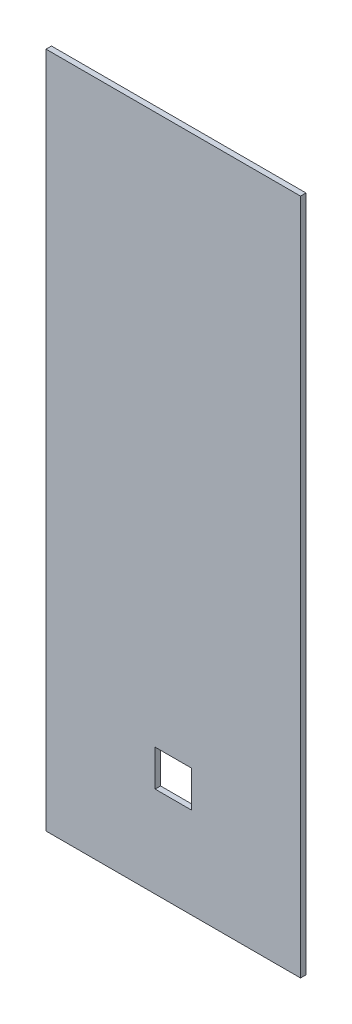
from build123d import *

# Parameters (mm, degrees)
SKETCH1_W           = 280
SKETCH1_H           = 745
BOSS_EXTRUDE1_DEPTH = 6
SKETCH2_W           = 40
SKETCH2_H           = 40
CUT_EXTRUDE1_DEPTH  = 398.98523842


with BuildPart() as part:
    # Sketch1 → Boss-Extrude1 (new body)
    with BuildSketch(Plane.XY):
        Rectangle(SKETCH1_W, SKETCH1_H)
    extrude(amount=BOSS_EXTRUDE1_DEPTH)

    # Sketch2 → Cut-Extrude1 (cut, through all)
    with BuildSketch(Plane.XY.offset(6)):
        with Locations((0, -252.5)):
            Rectangle(SKETCH2_W, SKETCH2_H)
    extrude(amount=-CUT_EXTRUDE1_DEPTH, mode=Mode.SUBTRACT)


solid = part.part
